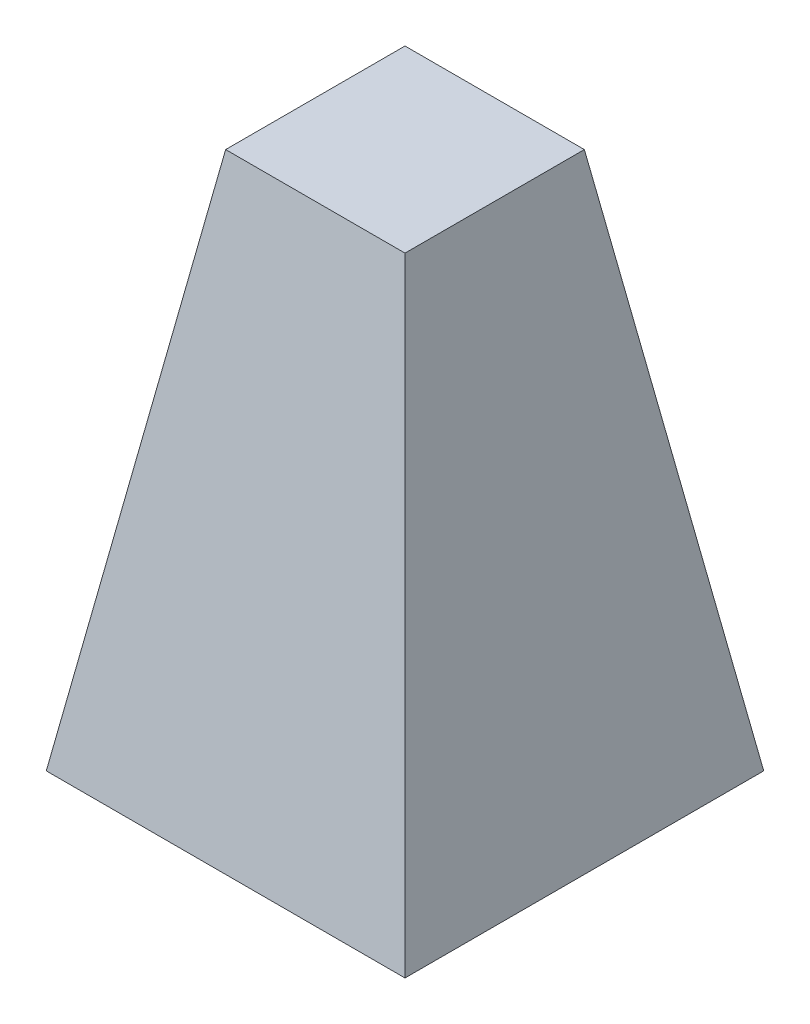
from build123d import *


with BuildPart() as part:
    # 草图1 → 放样1 section 0
    with BuildSketch(Plane(origin=(0, 0, 0), x_dir=(1, 0, 0), z_dir=(0, 1, 0))):
        with BuildLine():
            Line((0, 0), (50, 0))
            Line((50, 0), (50, 50))
            Line((50, 50), (0, 50))
            Line((0, 50), (0, 0))
        make_face()
    # 草图3 → 放样1 section 1
    with BuildSketch(Plane(origin=(0, 75, 0), x_dir=(1, 0, 0), z_dir=(0, 1, 0))):
        with BuildLine():
            Line((37.5, 37.5), (12.5, 37.5))
            Line((12.5, 37.5), (12.5, 12.5))
            Line((12.5, 12.5), (37.5, 12.5))
            Line((37.5, 12.5), (37.5, 37.5))
        make_face()
    loft()


solid = part.part
